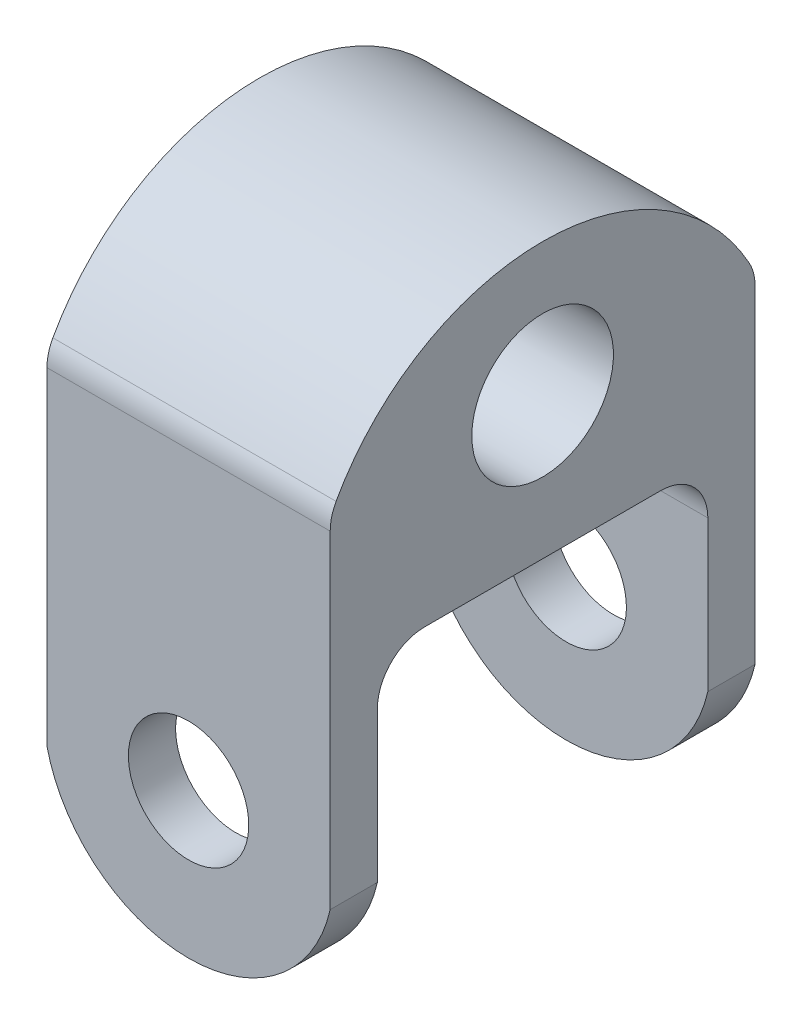
from build123d import *

# Parameters (mm, degrees)
ESQUISSE1_R             = 15
BOSS_EXTRU_1_DEPTH      = 60
ESQUISSE2_R             = 12.75
ENL_V_MAT_EXTRU_1_DEPTH = 148.309198627
CONG_1_R                = 10


with BuildPart() as part:
    # Esquisse1 → Boss.-Extru.1 (new body)
    with BuildSketch(Plane(origin=(0, 0, 0), x_dir=(0, 0, -1), z_dir=(1, 0, 0))):
        with BuildLine():
            ThreePointArc((45, 0), (0, 28.205505282), (-45, 0))
            Line((-45, 0), (-45, -100))
            Line((-45, -100), (-35, -100))
            Line((-35, -100), (-35, -30))
            Line((-35, -30), (35, -30))
            Line((35, -30), (35, -100))
            Line((35, -100), (45, -100))
            Line((45, -100), (45, 0))
        make_face()
        Circle(ESQUISSE1_R, mode=Mode.SUBTRACT)
    extrude(amount=BOSS_EXTRU_1_DEPTH)

    # Esquisse2 → Enlèv. mat.-Extru.1 (cut, through all)
    with BuildSketch(Plane(origin=(0, 0, -45), x_dir=(-1, 0, 0), z_dir=(0, 0, -1))):
        with Locations((-30, -65)):
            Circle(ESQUISSE2_R)
        with BuildLine():
            Line((-60, -71.861434349), (-96.965788421, -71.861434349))
            Line((-96.965788421, -71.861434349), (-96.965788421, -138.438192961))
            Line((-96.965788421, -138.438192961), (33.77611945, -138.438192961))
            Line((33.77611945, -138.438192961), (33.77611945, -71.861434349))
            Line((33.77611945, -71.861434349), (0, -71.861434349))
            ThreePointArc((0, -71.861434349), (-30, -95.774653228), (-60, -71.861434349))
        make_face()
    extrude(amount=-ENL_V_MAT_EXTRU_1_DEPTH, mode=Mode.SUBTRACT)

    # Congé1
    cong_1_edges = [part.edges().sort_by_distance(p)[0] for p in [
        (30, 0, -45),
        (30, 0, 45),
        (30, -30, 35),
        (30, -30, -35),
    ]]
    fillet(cong_1_edges, radius=CONG_1_R)


solid = part.part
